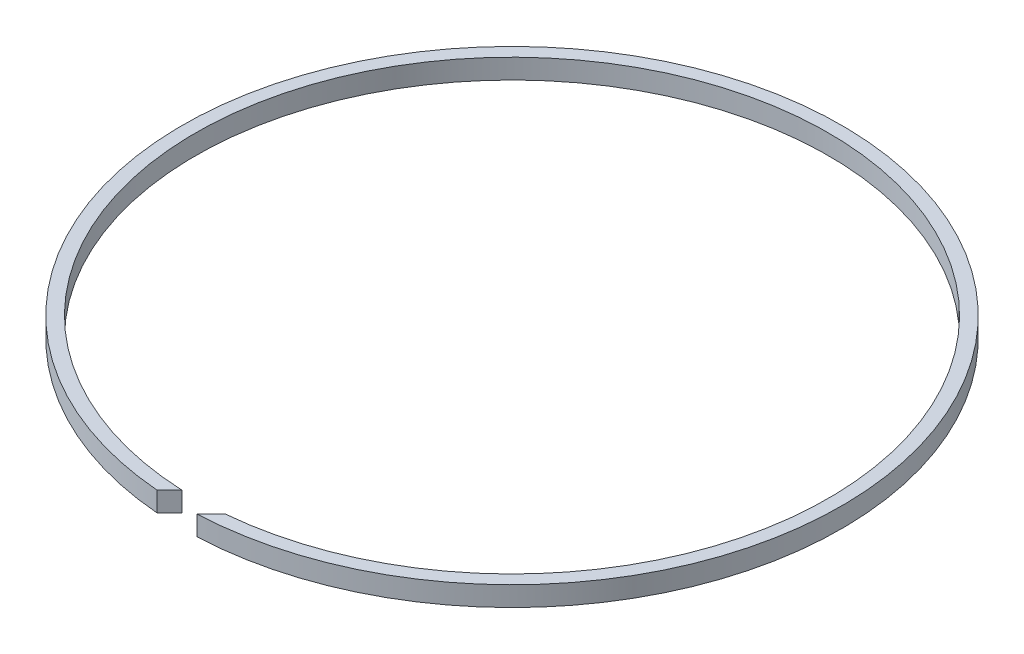
from build123d import *

# Parameters (mm, degrees)
SZKIC1_R                    = 63.5
SZKIC1_R_2                  = 60.96
DODANIE_WYCI_GNI_CIE1_DEPTH = 3.81
WYTNIJ_WYCI_GNI_CIE1_DEPTH  = 90.883347178


with BuildPart() as part:
    # Szkic1 → Dodanie-wyciągnięcie1 (new body)
    with BuildSketch(Plane(origin=(0, 0, 0), x_dir=(1, 0, 0), z_dir=(0, 1, 0))):
        with Locations(Location((0, 0, 0), (0, 0, 270))):
            Circle(SZKIC1_R)
        with Locations(Location((0, 0, 0), (0, 0, 270))):
            Circle(SZKIC1_R_2, mode=Mode.SUBTRACT)
    extrude(amount=DODANIE_WYCI_GNI_CIE1_DEPTH)

    # Szkic2 → Wytnij-wyciągnięcie1 (cut, through all)
    with BuildSketch(Plane(origin=(0, 3.81, 0), x_dir=(1, 0, 0), z_dir=(0, 1, 0))):
        Polygon((3.945128357, -58.284871643), (7.945128357, -58.284871643), (0.082457603, -66.147542397), (-7.917542397, -66.147542397), (-0.054871643, -58.284871643), align=None)
    extrude(amount=-WYTNIJ_WYCI_GNI_CIE1_DEPTH, mode=Mode.SUBTRACT)


solid = part.part
